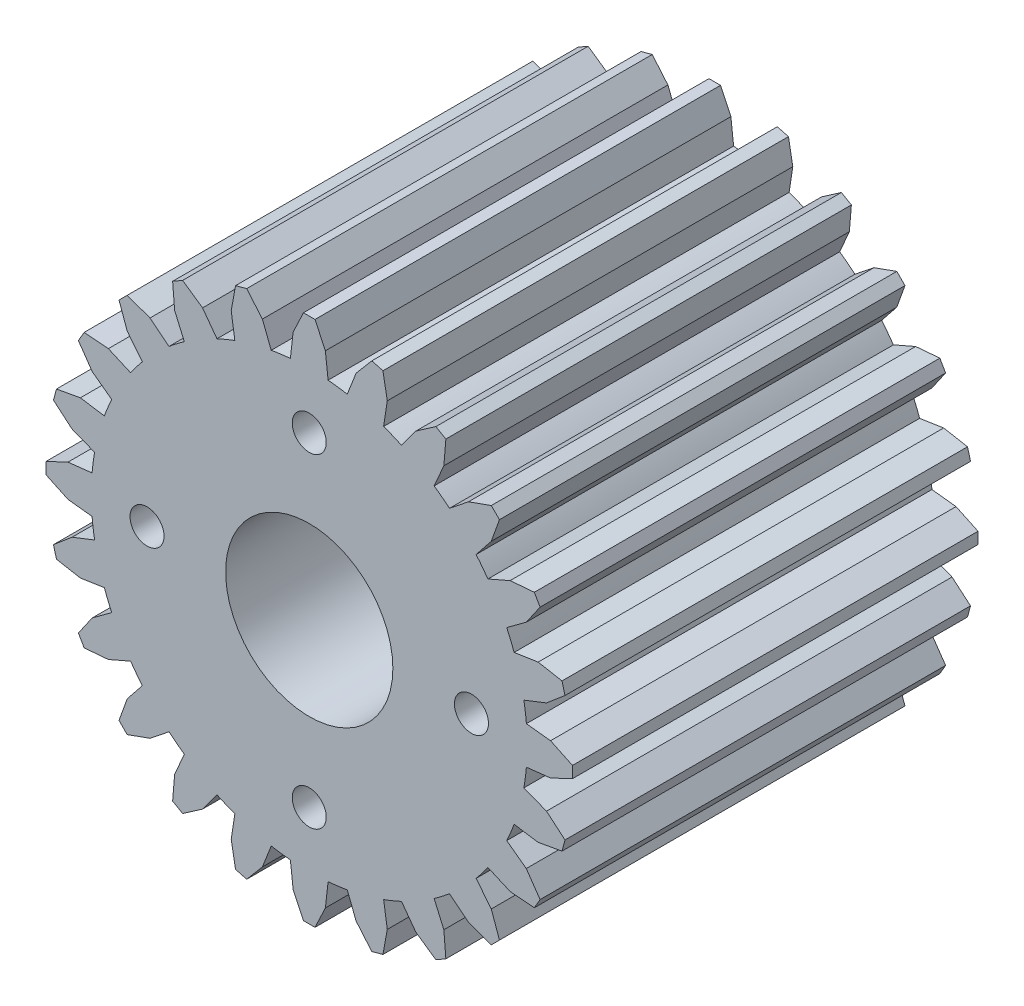
from build123d import *

# Parameters (mm, degrees)
BOSS_EXTRU_1_DEPTH      = 20
ECHELLE1_SCALE_X        = 0.5
ECHELLE1_SCALE_Y        = 0.5
ECHELLE1_SCALE_Z        = 1
ESQUISSE2_R             = 0.838714544
ESQUISSE2_R_2           = 4.125
ENL_V_MAT_EXTRU_3_DEPTH = 20


with BuildPart() as part:
    # Esquisse1 → Boss.-Extru.1 (new body)
    with BuildSketch(Plane.XY):
        with BuildLine():
            Line((-1.8585, 21.419523285), (-1.591531907, 23.799597451))
            Line((-1.591531907, 23.799597451), (-0.5695, 25.965578933))
            Line((-0.5695, 25.965578933), (0.5695, 25.965578933))
            Line((0.5695, 25.965578933), (1.591531907, 23.799597451))
            Line((1.591531907, 23.799597451), (1.8585, 21.419523285))
            ThreePointArc((1.8585, 21.419523285), (2.806313133, 21.31606452), (3.748607415, 21.170685923))
            Line((3.748607415, 21.170685923), (4.622487313, 23.400564602))
            Line((4.622487313, 23.400564602), (6.170291587, 25.228220732))
            Line((6.170291587, 25.228220732), (7.270481103, 24.93342584))
            Line((7.270481103, 24.93342584), (7.697090859, 22.576727065))
            Line((7.697090859, 22.576727065), (7.338953711, 20.208655532))
            ThreePointArc((7.338953711, 20.208655532), (8.227693796, 19.863409949), (9.100253429, 19.479101302))
            Line((9.100253429, 19.479101302), (10.521491663, 21.406821946))
            Line((10.521491663, 21.406821946), (12.489587999, 22.77160098))
            Line((12.489587999, 22.77160098), (13.475990934, 22.20210098))
            Line((13.475990934, 22.20210098), (13.278105788, 19.815290039))
            Line((13.278105788, 19.815290039), (12.319269855, 17.620601302))
            ThreePointArc((12.319269855, 17.620601302), (13.088370724, 17.057096816), (13.831732212, 16.460048117))
            Line((13.831732212, 16.460048117), (15.703473743, 17.954239751))
            Line((15.703473743, 17.954239751), (17.957739629, 18.763134253))
            Line((17.957739629, 18.763134253), (18.763134253, 17.957739629))
            Line((18.763134253, 17.957739629), (17.954239751, 15.703473743))
            Line((17.954239751, 15.703473743), (16.460048117, 13.831732212))
            ThreePointArc((16.460048117, 13.831732212), (17.057096816, 13.088370724), (17.620601302, 12.319269855))
            Line((17.620601302, 12.319269855), (19.815290039, 13.278105788))
            Line((19.815290039, 13.278105788), (22.20210098, 13.475990934))
            Line((22.20210098, 13.475990934), (22.77160098, 12.489587999))
            Line((22.77160098, 12.489587999), (21.406821946, 10.521491663))
            Line((21.406821946, 10.521491663), (19.479101302, 9.100253429))
            ThreePointArc((19.479101302, 9.100253429), (19.863409949, 8.227693796), (20.208655532, 7.338953711))
            Line((20.208655532, 7.338953711), (22.576727065, 7.697090859))
            Line((22.576727065, 7.697090859), (24.93342584, 7.270481103))
            Line((24.93342584, 7.270481103), (25.228220732, 6.170291587))
            Line((25.228220732, 6.170291587), (23.400564602, 4.622487313))
            Line((23.400564602, 4.622487313), (21.170685923, 3.748607415))
            ThreePointArc((21.170685923, 3.748607415), (21.31606452, 2.806313133), (21.419523285, 1.8585))
            Line((21.419523285, 1.8585), (23.799597451, 1.591531907))
            Line((23.799597451, 1.591531907), (25.965578933, 0.5695))
            Line((25.965578933, 0.5695), (25.965578933, -0.5695))
            Line((25.965578933, -0.5695), (23.799597451, -1.591531907))
            Line((23.799597451, -1.591531907), (21.419523285, -1.8585))
            ThreePointArc((21.419523285, -1.8585), (21.31606452, -2.806313133), (21.170685923, -3.748607415))
            Line((21.170685923, -3.748607415), (23.400564602, -4.622487313))
            Line((23.400564602, -4.622487313), (25.228220732, -6.170291587))
            Line((25.228220732, -6.170291587), (24.93342584, -7.270481103))
            Line((24.93342584, -7.270481103), (22.576727065, -7.697090859))
            Line((22.576727065, -7.697090859), (20.208655532, -7.338953711))
            ThreePointArc((20.208655532, -7.338953711), (19.863409949, -8.227693796), (19.479101302, -9.100253429))
            Line((19.479101302, -9.100253429), (21.406821946, -10.521491663))
            Line((21.406821946, -10.521491663), (22.77160098, -12.489587999))
            Line((22.77160098, -12.489587999), (22.20210098, -13.475990934))
            Line((22.20210098, -13.475990934), (19.815290039, -13.278105788))
            Line((19.815290039, -13.278105788), (17.620601302, -12.319269855))
            ThreePointArc((17.620601302, -12.319269855), (17.057096816, -13.088370724), (16.460048117, -13.831732212))
            Line((16.460048117, -13.831732212), (17.954239751, -15.703473743))
            Line((17.954239751, -15.703473743), (18.763134253, -17.957739629))
            Line((18.763134253, -17.957739629), (17.957739629, -18.763134253))
            Line((17.957739629, -18.763134253), (15.703473743, -17.954239751))
            Line((15.703473743, -17.954239751), (13.831732212, -16.460048117))
            ThreePointArc((13.831732212, -16.460048117), (13.088370724, -17.057096816), (12.319269855, -17.620601302))
            Line((12.319269855, -17.620601302), (13.278105788, -19.815290039))
            Line((13.278105788, -19.815290039), (13.475990934, -22.20210098))
            Line((13.475990934, -22.20210098), (12.489587999, -22.77160098))
            Line((12.489587999, -22.77160098), (10.521491663, -21.406821946))
            Line((10.521491663, -21.406821946), (9.100253429, -19.479101302))
            ThreePointArc((9.100253429, -19.479101302), (8.227693796, -19.863409949), (7.338953711, -20.208655532))
            Line((7.338953711, -20.208655532), (7.697090859, -22.576727065))
            Line((7.697090859, -22.576727065), (7.270481103, -24.93342584))
            Line((7.270481103, -24.93342584), (6.170291587, -25.228220732))
            Line((6.170291587, -25.228220732), (4.622487313, -23.400564602))
            Line((4.622487313, -23.400564602), (3.748607415, -21.170685923))
            ThreePointArc((3.748607415, -21.170685923), (2.806313133, -21.31606452), (1.8585, -21.419523285))
            Line((1.8585, -21.419523285), (1.591531907, -23.799597451))
            Line((1.591531907, -23.799597451), (0.5695, -25.965578933))
            Line((0.5695, -25.965578933), (-0.5695, -25.965578933))
            Line((-0.5695, -25.965578933), (-1.591531907, -23.799597451))
            Line((-1.591531907, -23.799597451), (-1.8585, -21.419523285))
            ThreePointArc((-1.8585, -21.419523285), (-2.806313133, -21.31606452), (-3.748607415, -21.170685923))
            Line((-3.748607415, -21.170685923), (-4.622487313, -23.400564602))
            Line((-4.622487313, -23.400564602), (-6.170291587, -25.228220732))
            Line((-6.170291587, -25.228220732), (-7.270481103, -24.93342584))
            Line((-7.270481103, -24.93342584), (-7.697090859, -22.576727065))
            Line((-7.697090859, -22.576727065), (-7.338953711, -20.208655532))
            ThreePointArc((-7.338953711, -20.208655532), (-8.227693796, -19.863409949), (-9.100253429, -19.479101302))
            Line((-9.100253429, -19.479101302), (-10.521491663, -21.406821946))
            Line((-10.521491663, -21.406821946), (-12.489587999, -22.77160098))
            Line((-12.489587999, -22.77160098), (-13.475990934, -22.20210098))
            Line((-13.475990934, -22.20210098), (-13.278105788, -19.815290039))
            Line((-13.278105788, -19.815290039), (-12.319269855, -17.620601302))
            ThreePointArc((-12.319269855, -17.620601302), (-13.088370724, -17.057096816), (-13.831732212, -16.460048117))
            Line((-13.831732212, -16.460048117), (-15.703473743, -17.954239751))
            Line((-15.703473743, -17.954239751), (-17.957739629, -18.763134253))
            Line((-17.957739629, -18.763134253), (-18.763134253, -17.957739629))
            Line((-18.763134253, -17.957739629), (-17.954239751, -15.703473743))
            Line((-17.954239751, -15.703473743), (-16.460048117, -13.831732212))
            ThreePointArc((-16.460048117, -13.831732212), (-17.057096816, -13.088370724), (-17.620601302, -12.319269855))
            Line((-17.620601302, -12.319269855), (-19.815290039, -13.278105788))
            Line((-19.815290039, -13.278105788), (-22.20210098, -13.475990934))
            Line((-22.20210098, -13.475990934), (-22.77160098, -12.489587999))
            Line((-22.77160098, -12.489587999), (-21.406821946, -10.521491663))
            Line((-21.406821946, -10.521491663), (-19.479101302, -9.100253429))
            ThreePointArc((-19.479101302, -9.100253429), (-19.863409949, -8.227693796), (-20.208655532, -7.338953711))
            Line((-20.208655532, -7.338953711), (-22.576727065, -7.697090859))
            Line((-22.576727065, -7.697090859), (-24.93342584, -7.270481103))
            Line((-24.93342584, -7.270481103), (-25.228220732, -6.170291587))
            Line((-25.228220732, -6.170291587), (-23.400564602, -4.622487313))
            Line((-23.400564602, -4.622487313), (-21.170685923, -3.748607415))
            ThreePointArc((-21.170685923, -3.748607415), (-21.31606452, -2.806313133), (-21.419523285, -1.8585))
            Line((-21.419523285, -1.8585), (-23.799597451, -1.591531907))
            Line((-23.799597451, -1.591531907), (-25.965578933, -0.5695))
            Line((-25.965578933, -0.5695), (-25.965578933, 0.5695))
            Line((-25.965578933, 0.5695), (-23.799597451, 1.591531907))
            Line((-23.799597451, 1.591531907), (-21.419523285, 1.8585))
            ThreePointArc((-21.419523285, 1.8585), (-21.31606452, 2.806313133), (-21.170685923, 3.748607415))
            Line((-21.170685923, 3.748607415), (-23.400564602, 4.622487313))
            Line((-23.400564602, 4.622487313), (-25.228220732, 6.170291587))
            Line((-25.228220732, 6.170291587), (-24.93342584, 7.270481103))
            Line((-24.93342584, 7.270481103), (-22.576727065, 7.697090859))
            Line((-22.576727065, 7.697090859), (-20.208655532, 7.338953711))
            ThreePointArc((-20.208655532, 7.338953711), (-19.863409949, 8.227693796), (-19.479101302, 9.100253429))
            Line((-19.479101302, 9.100253429), (-21.406821946, 10.521491663))
            Line((-21.406821946, 10.521491663), (-22.77160098, 12.489587999))
            Line((-22.77160098, 12.489587999), (-22.20210098, 13.475990934))
            Line((-22.20210098, 13.475990934), (-19.815290039, 13.278105788))
            Line((-19.815290039, 13.278105788), (-17.620601302, 12.319269855))
            ThreePointArc((-17.620601302, 12.319269855), (-17.057096816, 13.088370724), (-16.460048117, 13.831732212))
            Line((-16.460048117, 13.831732212), (-17.954239751, 15.703473743))
            Line((-17.954239751, 15.703473743), (-18.763134253, 17.957739629))
            Line((-18.763134253, 17.957739629), (-17.957739629, 18.763134253))
            Line((-17.957739629, 18.763134253), (-15.703473743, 17.954239751))
            Line((-15.703473743, 17.954239751), (-13.831732212, 16.460048117))
            ThreePointArc((-13.831732212, 16.460048117), (-13.088370724, 17.057096816), (-12.319269855, 17.620601302))
            Line((-12.319269855, 17.620601302), (-13.278105788, 19.815290039))
            Line((-13.278105788, 19.815290039), (-13.475990934, 22.20210098))
            Line((-13.475990934, 22.20210098), (-12.489587999, 22.77160098))
            Line((-12.489587999, 22.77160098), (-10.521491663, 21.406821946))
            Line((-10.521491663, 21.406821946), (-9.100253429, 19.479101302))
            ThreePointArc((-9.100253429, 19.479101302), (-8.227693796, 19.863409949), (-7.338953711, 20.208655532))
            Line((-7.338953711, 20.208655532), (-7.697090859, 22.576727065))
            Line((-7.697090859, 22.576727065), (-7.270481103, 24.93342584))
            Line((-7.270481103, 24.93342584), (-6.170291587, 25.228220732))
            Line((-6.170291587, 25.228220732), (-4.622487313, 23.400564602))
            Line((-4.622487313, 23.400564602), (-3.748607415, 21.170685923))
            ThreePointArc((-3.748607415, 21.170685923), (-2.806313133, 21.31606452), (-1.8585, 21.419523285))
        make_face()
    extrude(amount=BOSS_EXTRU_1_DEPTH)


with BuildPart() as part_1:
    # Echelle1: scaled about (0, 0, 10)
    add(part.part.scale((ECHELLE1_SCALE_X, ECHELLE1_SCALE_Y, ECHELLE1_SCALE_Z), about=(0, 0, 10)))

    # Esquisse2 → Enlèv. mat.-Extru.3 (cut)
    with BuildSketch(Plane.XY.offset(20)):
        with Locations((0, 8)):
            Circle(ESQUISSE2_R)
        Circle(ESQUISSE2_R_2)
        with Locations((8, 0)):
            Circle(ESQUISSE2_R)
        with Locations((0, -8)):
            Circle(ESQUISSE2_R)
        with Locations((-8, 0)):
            Circle(ESQUISSE2_R)
    extrude(amount=-ENL_V_MAT_EXTRU_3_DEPTH, mode=Mode.SUBTRACT)


solid = part_1.part
